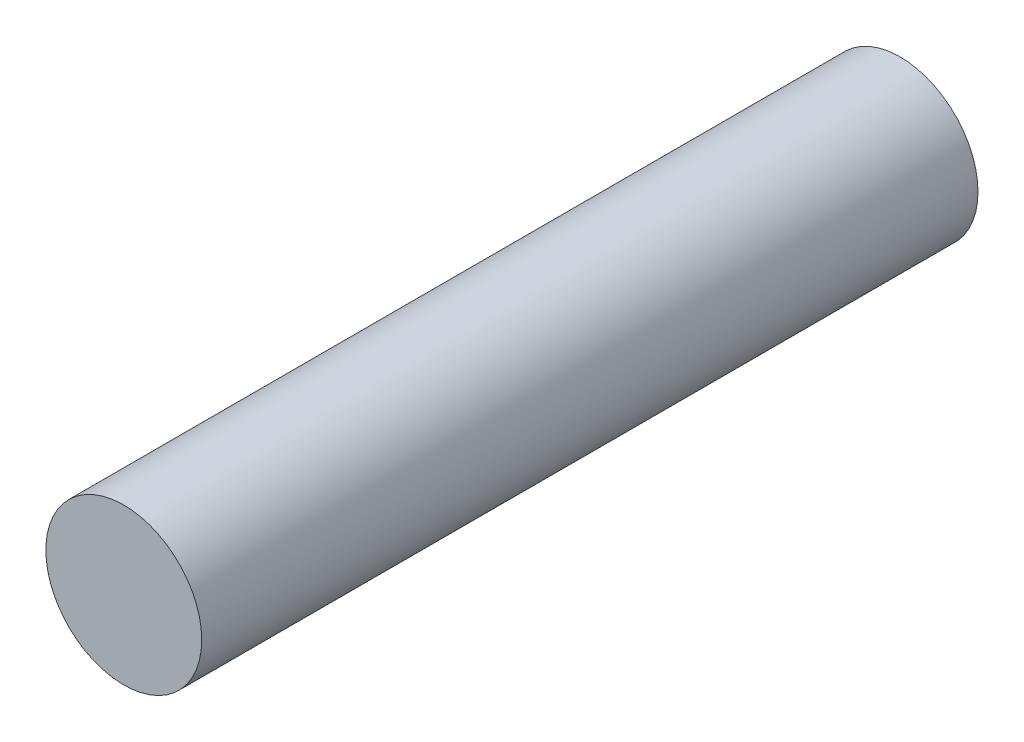
from build123d import *

# Parameters (mm, degrees)
SKETCH1_R           = 3.1877
BOSS_EXTRUDE1_DEPTH = 31.75


with BuildPart() as part:
    # Sketch1 → Boss-Extrude1 (new body)
    with BuildSketch(Plane.XY):
        Circle(SKETCH1_R)
    extrude(amount=BOSS_EXTRUDE1_DEPTH)


solid = part.part
